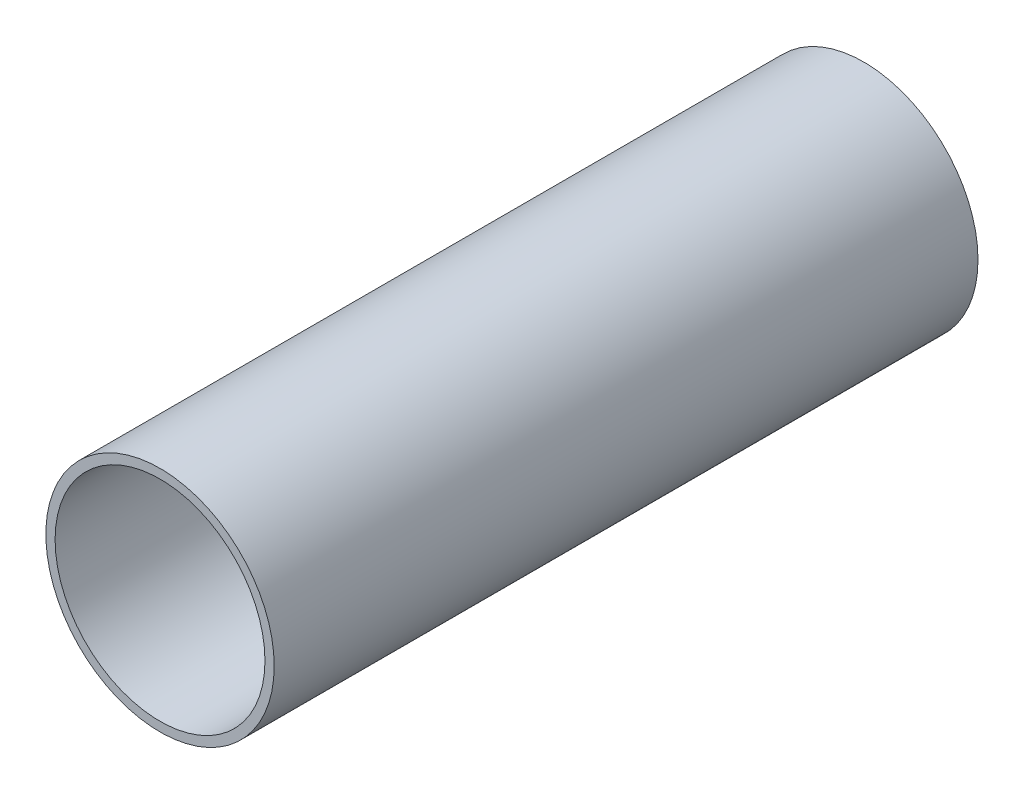
from build123d import *

# Parameters (mm, degrees)
BOSS_EXTRUDE1_DEPTH      = 53.23
BOSS_EXTRUDE1_DEPTH_BACK = 53.23
SKETCH3_R                = 17.272
SKETCH3_R_2              = 15.875


with BuildPart() as part:
    # Sketch3 → Boss-Extrude1 (new, two sides: drawn at the far end of the back side and taken through both)
    with BuildSketch(Plane.XY.offset(-BOSS_EXTRUDE1_DEPTH_BACK)):
        Circle(SKETCH3_R)
        Circle(SKETCH3_R_2, mode=Mode.SUBTRACT)
    extrude(amount=BOSS_EXTRUDE1_DEPTH + BOSS_EXTRUDE1_DEPTH_BACK)


solid = part.part
